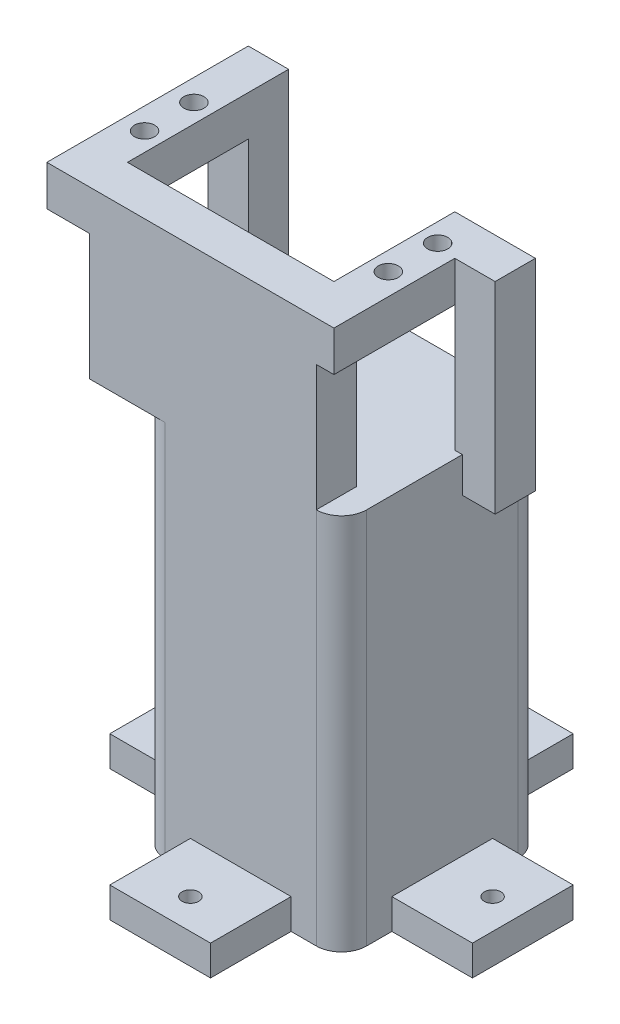
from build123d import *

# Parameters (mm, degrees)
SKETCH_1_R      = 1.65
EXTRUDE_1_DEPTH = 6
EXTRUDE_2_DEPTH = 75
EXTRUDE_START   = 25
SKETCH_3_R      = 2
EXTRUDE_3_DEPTH = 8
EXTRUDE_4_REACH = 93.669
SKETCH_5_W      = 45
SKETCH_5_H      = 8
EXTRUDE_START_2 = 33
SKETCH_6_W      = 8
SKETCH_6_H      = 8
EXTRUDE_5_DEPTH = 40
SKETCH_7_W      = 8
SKETCH_7_H      = 8
EXTRUDE_6_DEPTH = 50
SKETCH_8_W      = 8
SKETCH_8_H      = 17
EXTRUDE_7_DEPTH = 40


with BuildPart() as part:
    # 草图1 → 凸台-拉伸1 (new body)
    with BuildSketch(Plane(origin=(0, 0, 0), x_dir=(1, 0, 0), z_dir=(0, 1, 0))):
        Polygon((-10, 36), (-10, 10), (-36, 10), (-36, -10), (-10, -10), (-10, -36), (10, -36), (10, -10), (36, -10), (36, 10), (10, 10), (10, 36), align=None)
        with Locations(Location((0, 30, 0), (0, 0, 270))):
            Circle(SKETCH_1_R, mode=Mode.SUBTRACT)
        with Locations(Location((30, 0, 0), (0, 0, 270))):
            Circle(SKETCH_1_R, mode=Mode.SUBTRACT)
        with Locations(Location((0, -30, 0), (0, 0, 270))):
            Circle(SKETCH_1_R, mode=Mode.SUBTRACT)
        with Locations(Location((-30, 0, 0), (0, 0, 270))):
            Circle(SKETCH_1_R, mode=Mode.SUBTRACT)
    extrude(amount=EXTRUDE_1_DEPTH)

    # 草图2 → 凸台-拉伸2 (add)
    with BuildSketch(Plane(origin=(0, 0, 0), x_dir=(1, 0, 0), z_dir=(0, 1, 0))):
        with BuildLine():
            Line((-15, 20), (15, 20))
            ThreePointArc((15, 20), (18.535533906, 18.535533906), (20, 15))
            Line((20, 15), (20, -15))
            ThreePointArc((20, -15), (18.535533906, -18.535533906), (15, -20))
            Line((15, -20), (-15, -20))
            ThreePointArc((-15, -20), (-18.535533906, -18.535533906), (-20, -15))
            Line((-20, -15), (-20, 15))
            ThreePointArc((-20, 15), (-18.535533906, 18.535533906), (-15, 20))
        make_face()
    extrude(amount=EXTRUDE_2_DEPTH)


with BuildPart() as body_2:
    # 草图3 → 凸台-拉伸3 (new body)
    with BuildSketch(Plane(origin=(0, 75, 0), x_dir=(1, 0, 0), z_dir=(0, 1, 0)).offset(EXTRUDE_START)):
        Polygon((-38.5, -20), (18.5, -20), (18.5, 12), (10.5, 12), (10.5, -12), (-30.5, -12), (-30.5, 12), (-38.5, 12), align=None)
        with Locations(Location((-34.2, -4.9, 0), (0, 0, 90))):
            Circle(SKETCH_3_R, mode=Mode.SUBTRACT)
        with Locations(Location((-34.2, 4.9, 0), (0, 0, 90))):
            Circle(SKETCH_3_R, mode=Mode.SUBTRACT)
        with Locations(Location((14.2, -4.9, 0), (0, 0, 90))):
            Circle(SKETCH_3_R, mode=Mode.SUBTRACT)
        with Locations(Location((14.2, 4.9, 0), (0, 0, 90))):
            Circle(SKETCH_3_R, mode=Mode.SUBTRACT)
    extrude(amount=EXTRUDE_3_DEPTH)

    # 草图5 → 凸台-拉伸4 (add, up to next)
    with BuildSketch(Plane(origin=(0, 75, 0), x_dir=(1, 0, 0), z_dir=(0, 1, 0)), mode=Mode.PRIVATE) as extrude_4_sk1:
        with Locations((-7.5, -16)):
            Rectangle(SKETCH_5_W, SKETCH_5_H)
    extrude_4_tool1 = extrude(extrude_4_sk1.sketch, amount=EXTRUDE_4_REACH, mode=Mode.PRIVATE) - body_2.part

    add(part.part)  # 凸台-拉伸4 merges part
    add(extrude_4_tool1.solids().sort_by_distance((-7.5, 75, 16))[0])

    # 草图6 → 凸台-拉伸5 (add)
    with BuildSketch(Plane(origin=(0, 75, 0), x_dir=(1, 0, 0), z_dir=(0, 1, 0)).offset(EXTRUDE_START_2)):
        with Locations((22.5, 8)):
            Rectangle(SKETCH_6_W, SKETCH_6_H)
    extrude(amount=-EXTRUDE_5_DEPTH)

    # 草图7 → 凸台-拉伸6 (add)
    with BuildSketch(Plane(origin=(0, 108, 0), x_dir=(1, 0, 0), z_dir=(0, 1, 0))):
        with Locations((-34.5, 16)):
            Rectangle(SKETCH_7_W, SKETCH_7_H)
    extrude(amount=-EXTRUDE_6_DEPTH)

    # 草图8 → 凸台-拉伸7 (add)
    with BuildSketch(Plane.ZY.offset(38.5)):
        with Locations((-16, 66.5)):
            Rectangle(SKETCH_8_W, SKETCH_8_H)
    extrude(amount=-EXTRUDE_7_DEPTH)


solid = body_2.part
